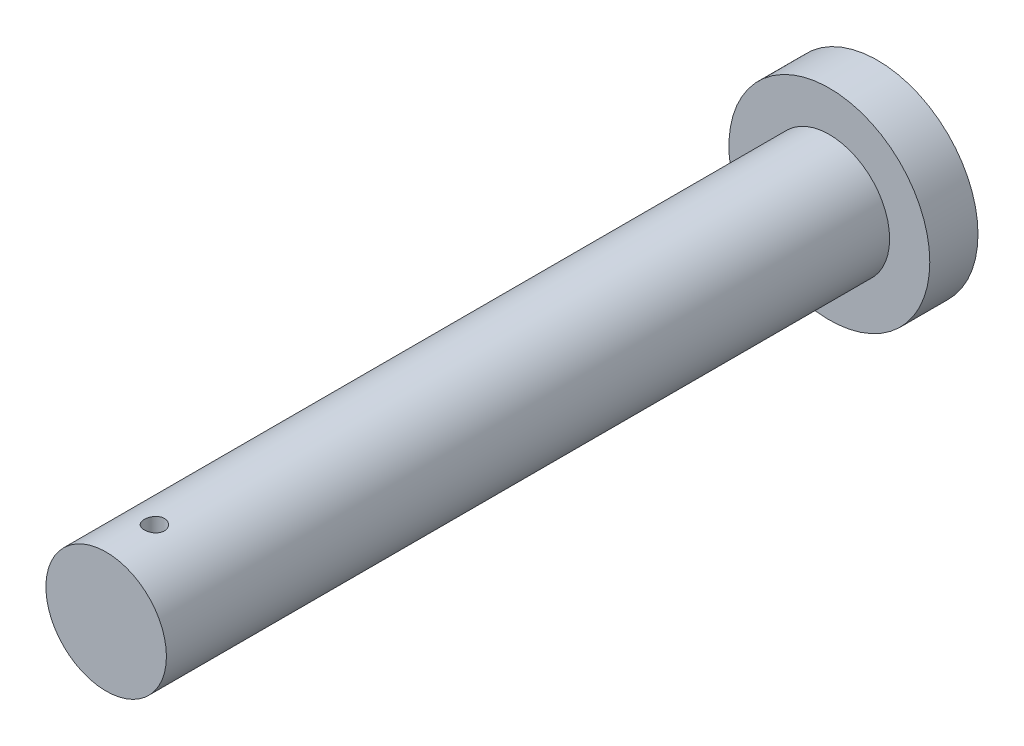
from build123d import *

# Parameters (mm, degrees)
SKETCH1_R               = 25
BOSS_EXTRUDE1_DEPTH     = 12
SKETCH2_R               = 15
BOSS_EXTRUDE2_DEPTH     = 180
CUT_EXTRUDE1_DEPTH      = 196.228071752
CUT_EXTRUDE1_DEPTH_BACK = 196.228071752
SKETCH3_R               = 2.5


with BuildPart() as part:
    # Sketch1 → Boss-Extrude1 (new body)
    with BuildSketch(Plane.XY):
        Circle(SKETCH1_R)
    extrude(amount=BOSS_EXTRUDE1_DEPTH)

    # Sketch2 → Boss-Extrude2 (add)
    with BuildSketch(Plane.XY.offset(12)):
        with Locations(Location((0, 0, 0), (0, 0, 180))):
            Circle(SKETCH2_R)
    extrude(amount=BOSS_EXTRUDE2_DEPTH)

    # Sketch3 → Cut-Extrude1 (cut, two sides: drawn at the far end of the back side and taken through both)
    with BuildSketch(Plane(origin=(0, 0, 0), x_dir=(1, 0, 0), z_dir=(0, 1, 0)).offset(-CUT_EXTRUDE1_DEPTH_BACK)):
        with Locations(Location((0, -180, 0), (0, 0, 270))):
            Circle(SKETCH3_R)
    extrude(amount=CUT_EXTRUDE1_DEPTH + CUT_EXTRUDE1_DEPTH_BACK, mode=Mode.SUBTRACT)


solid = part.part
